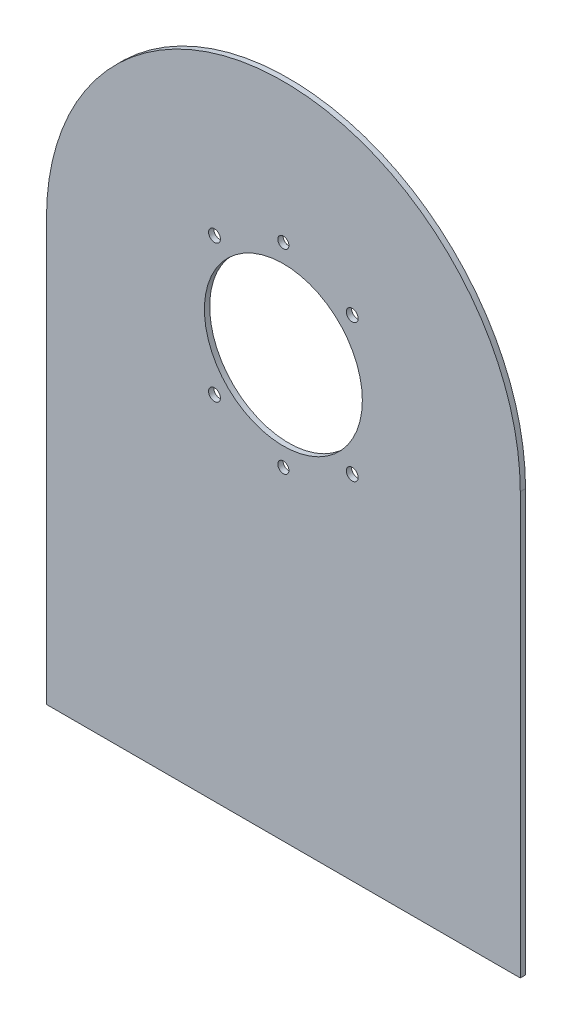
from build123d import *

# Parameters (mm, degrees)
ESQUISSE1_R             = 30
BOSS_EXTRU_1_DEPTH      = 2
ENL_V_MAT_EXTRU_1_REACH = 185.586
ESQUISSE2_R             = 2.25
ESQUISSE2_R_2           = 2.1
ESQUISSE4_R             = 2
GOUJON_M4X20_DEPTH      = 20


with BuildPart() as part:
    # Esquisse1 → Boss.-Extru.1 (new body)
    with BuildSketch(Plane.XY):
        with BuildLine():
            Line((-90, -160), (90, -160))
            Line((90, -160), (90, 0))
            ThreePointArc((90, 0), (0, 90), (-90, 0))
            Line((-90, 0), (-90, -160))
        make_face()
        Circle(ESQUISSE1_R, mode=Mode.SUBTRACT)
    extrude(amount=BOSS_EXTRU_1_DEPTH)

    # Esquisse2 → Enlèv. mat.-Extru.1 (cut, up to next)
    with BuildSketch(Plane.XY.offset(2), mode=Mode.PRIVATE) as enl_v_mat_extru_1_sk1:
        with Locations((26.162950904, 26.162950904)):
            Circle(ESQUISSE2_R)
    enl_v_mat_extru_1_tool1 = extrude(enl_v_mat_extru_1_sk1.sketch, amount=-ENL_V_MAT_EXTRU_1_REACH, mode=Mode.PRIVATE) & part.part
    # Esquisse2 → Enlèv. mat.-Extru.1 (cut, up to next)
    with BuildSketch(Plane.XY.offset(2), mode=Mode.PRIVATE) as enl_v_mat_extru_1_sk2:
        with Locations((-26.162950904, -26.162950904)):
            Circle(ESQUISSE2_R)
    enl_v_mat_extru_1_tool2 = extrude(enl_v_mat_extru_1_sk2.sketch, amount=-ENL_V_MAT_EXTRU_1_REACH, mode=Mode.PRIVATE) & part.part
    # Esquisse2 → Enlèv. mat.-Extru.1 (cut, up to next)
    with BuildSketch(Plane.XY.offset(2), mode=Mode.PRIVATE) as enl_v_mat_extru_1_sk3:
        with Locations((-26.162950904, 26.162950904)):
            Circle(ESQUISSE2_R)
    enl_v_mat_extru_1_tool3 = extrude(enl_v_mat_extru_1_sk3.sketch, amount=-ENL_V_MAT_EXTRU_1_REACH, mode=Mode.PRIVATE) & part.part
    # Esquisse2 → Enlèv. mat.-Extru.1 (cut, up to next)
    with BuildSketch(Plane.XY.offset(2), mode=Mode.PRIVATE) as enl_v_mat_extru_1_sk4:
        with Locations((26.162950904, -26.162950904)):
            Circle(ESQUISSE2_R)
    enl_v_mat_extru_1_tool4 = extrude(enl_v_mat_extru_1_sk4.sketch, amount=-ENL_V_MAT_EXTRU_1_REACH, mode=Mode.PRIVATE) & part.part
    # Esquisse2 → Enlèv. mat.-Extru.1 (cut, up to next)
    with BuildSketch(Plane.XY.offset(2), mode=Mode.PRIVATE) as enl_v_mat_extru_1_sk5:
        with Locations((0, 37)):
            Circle(ESQUISSE2_R_2)
    enl_v_mat_extru_1_tool5 = extrude(enl_v_mat_extru_1_sk5.sketch, amount=-ENL_V_MAT_EXTRU_1_REACH, mode=Mode.PRIVATE) & part.part
    # Esquisse2 → Enlèv. mat.-Extru.1 (cut, up to next)
    with BuildSketch(Plane.XY.offset(2), mode=Mode.PRIVATE) as enl_v_mat_extru_1_sk6:
        with Locations((0, -37)):
            Circle(ESQUISSE2_R_2)
    enl_v_mat_extru_1_tool6 = extrude(enl_v_mat_extru_1_sk6.sketch, amount=-ENL_V_MAT_EXTRU_1_REACH, mode=Mode.PRIVATE) & part.part
    add(enl_v_mat_extru_1_tool1.solids().sort_by_distance((26.162951, 26.162951, 2))[0], mode=Mode.SUBTRACT)
    add(enl_v_mat_extru_1_tool2.solids().sort_by_distance((-26.162951, -26.162951, 2))[0], mode=Mode.SUBTRACT)
    add(enl_v_mat_extru_1_tool3.solids().sort_by_distance((-26.162951, 26.162951, 2))[0], mode=Mode.SUBTRACT)
    add(enl_v_mat_extru_1_tool4.solids().sort_by_distance((26.162951, -26.162951, 2))[0], mode=Mode.SUBTRACT)
    add(enl_v_mat_extru_1_tool5.solids().sort_by_distance((0, 37, 2))[0], mode=Mode.SUBTRACT)
    add(enl_v_mat_extru_1_tool6.solids().sort_by_distance((0, -37, 2))[0], mode=Mode.SUBTRACT)

    # Esquisse4 → Goujon M4x20 (add)
    with BuildSketch(Plane(origin=(0, 0, 0), x_dir=(-1, 0, 0), z_dir=(0, 0, -1))):
        with Locations((-20, -100)):
            Circle(ESQUISSE4_R)
        with Locations((20, -100)):
            Circle(ESQUISSE4_R)
    extrude(amount=GOUJON_M4X20_DEPTH)


solid = part.part
